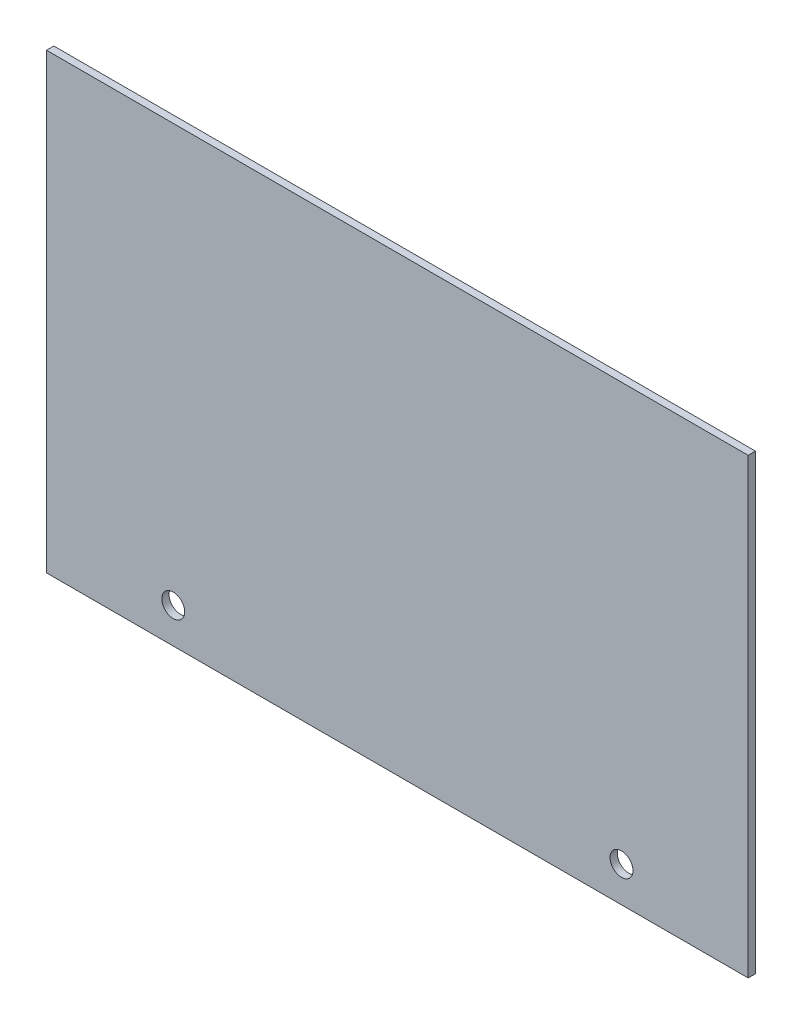
from build123d import *

# Parameters (mm, degrees)
SKETCH1_W           = 306.05
SKETCH1_H           = 197.425
SKETCH1_R           = 10.775
BOSS_EXTRUDE1_DEPTH = 3.175
SKETCH2_R           = 5
CUT_EXTRUDE1_DEPTH  = 183.128770122


with BuildPart() as part:
    # Sketch1 → Boss-Extrude1 (new body)
    # profile 1 of 5: a face of its own
    with BuildSketch(Plane.XY):
        Rectangle(SKETCH1_W, SKETCH1_H)
        with Locations((-142.25, -87.9375)):
            Circle(SKETCH1_R, mode=Mode.SUBTRACT)
        with Locations((-130.25, -64.9375)):
            Circle(SKETCH1_R, mode=Mode.SUBTRACT)
    # profile 2 of 5: a face of its own
    with BuildSketch(Plane.XY):
        with Locations((-130.25, -64.9375)):
            Circle(SKETCH1_R)
    # profile 3 of 5: a face of its own
    with BuildSketch(Plane.XY):
        with Locations((-142.25, -87.9375)):
            Circle(SKETCH1_R)
    # profile 4 of 5: a face of its own
    with BuildSketch(Plane.XY):
        with BuildLine():
            ThreePointArc((-142.25, -98.7125), (-149.869075567, -95.556575567), (-153.025, -87.9375))
            Line((-153.025, -87.9375), (-153.025, -98.7125))
            Line((-153.025, -98.7125), (-142.25, -98.7125))
        make_face()
    # profile 5 of 5: a face of its own
    with BuildSketch(Plane.XY):
        Rectangle(SKETCH1_W, SKETCH1_H)
    extrude(amount=BOSS_EXTRUDE1_DEPTH)

    # Sketch2 → Cut-Extrude1 (cut, through all)
    with BuildSketch(Plane(origin=(0, 0, 0), x_dir=(-1, 0, 0), z_dir=(0, 0, -1))):
        with Locations((-97.75, -83.334)):
            Circle(SKETCH2_R)
    cut_extrude1 = extrude(amount=-CUT_EXTRUDE1_DEPTH, mode=Mode.SUBTRACT)

    # Mirror1: Cut-Extrude1 across plane
    add(cut_extrude1.mirror(Plane(origin=(0, 0, 0), x_dir=(0, 0, 1), z_dir=(1, 0, 0))), mode=Mode.SUBTRACT)


solid = part.part
